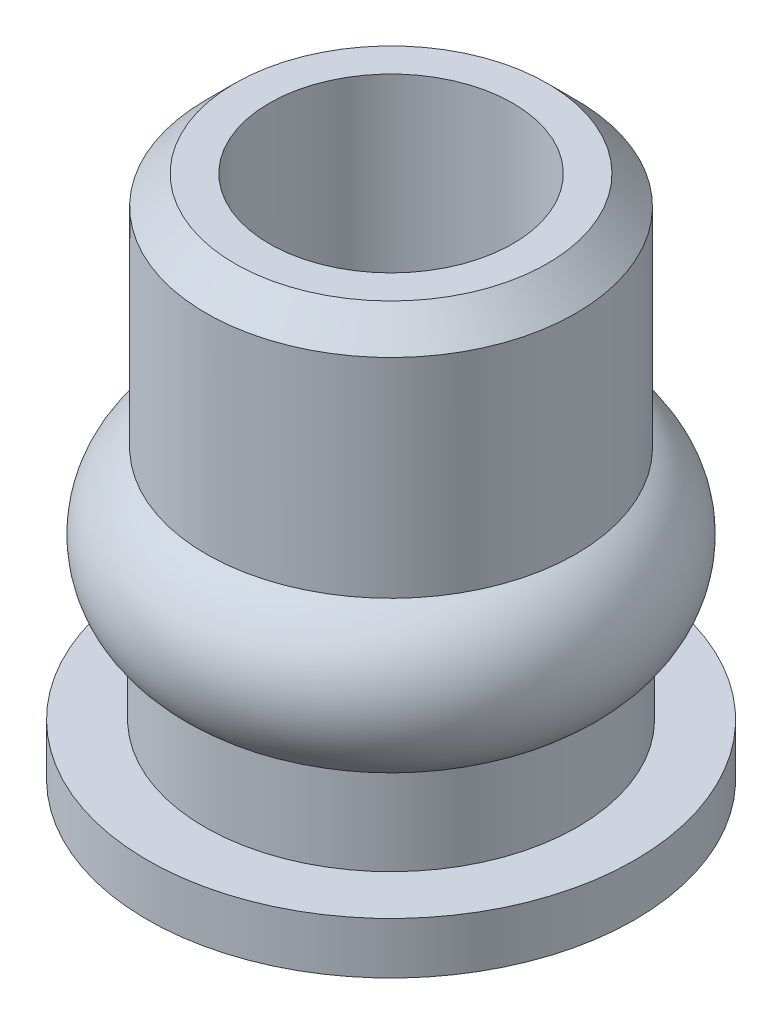
from build123d import *

# Parameters (mm, degrees)
HOLE_WIZARD_M10_1_D     = 8.5
HOLE_WIZARD_M10_1_DEPTH = 24.5
HOLE_WIZARD_M10_1_TIP   = 2.553657631
CHAMFER_1_SIZE          = 1


with BuildPart() as part:
    # 草图1 → 旋转1 (revolve)
    with BuildSketch(Plane.XY):
        with BuildLine():
            Line((0, 0), (8.5, 0))
            Line((8.5, 0), (8.5, 1.8))
            Line((8.5, 1.8), (6.5, 1.8))
            Line((6.5, 1.8), (6.5, 4.8))
            ThreePointArc((6.5, 4.8), (7.999862618, 7.426786408), (6.45, 10.024385409))
            Line((6.45, 10.024385409), (6.45, 18.3))
            Line((6.45, 18.3), (0, 18.3))
            Line((0, 18.3), (0, 0))
        make_face()
    revolve(axis=Axis((0, 0, 0), (0, 1, 0)))

    # M10 螺纹孔1
    with Locations(Plane(origin=(0, 0, 0), x_dir=(-1, 0, 0), z_dir=(0, -1, 0))):
        with Locations((0, 0)):
            Hole(HOLE_WIZARD_M10_1_D / 2, depth=HOLE_WIZARD_M10_1_DEPTH)
            with Locations((0, 0, -(HOLE_WIZARD_M10_1_DEPTH + HOLE_WIZARD_M10_1_TIP / 2))):  # 118° drill point
                Cone(0, HOLE_WIZARD_M10_1_D / 2, HOLE_WIZARD_M10_1_TIP, mode=Mode.SUBTRACT)

    # 倒角1
    chamfer_1_edges = [part.edges().sort_by_distance(p)[0] for p in [
        (-6.45, 18.3, 0),
    ]]
    chamfer(chamfer_1_edges, length=CHAMFER_1_SIZE)


solid = part.part
